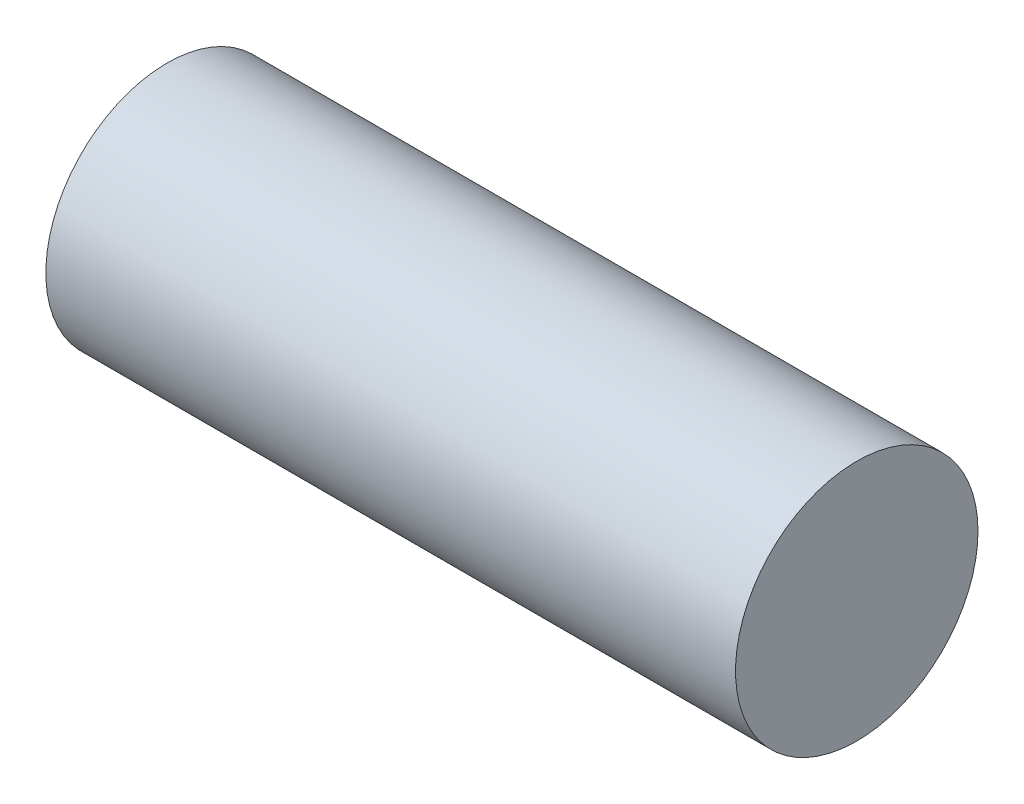
from build123d import *

# Parameters (mm, degrees)
SKETCH_1_R      = 4.5
EXTRUDE_1_DEPTH = 25.6


with BuildPart() as part:
    # 草图1 → 凸台-拉伸1 (new body)
    with BuildSketch(Plane(origin=(0, 0, 0), x_dir=(0, 0, -1), z_dir=(1, 0, 0))):
        with Locations((-38.467409768, 25.167507455)):
            Circle(SKETCH_1_R)
    extrude(amount=EXTRUDE_1_DEPTH)


solid = part.part
